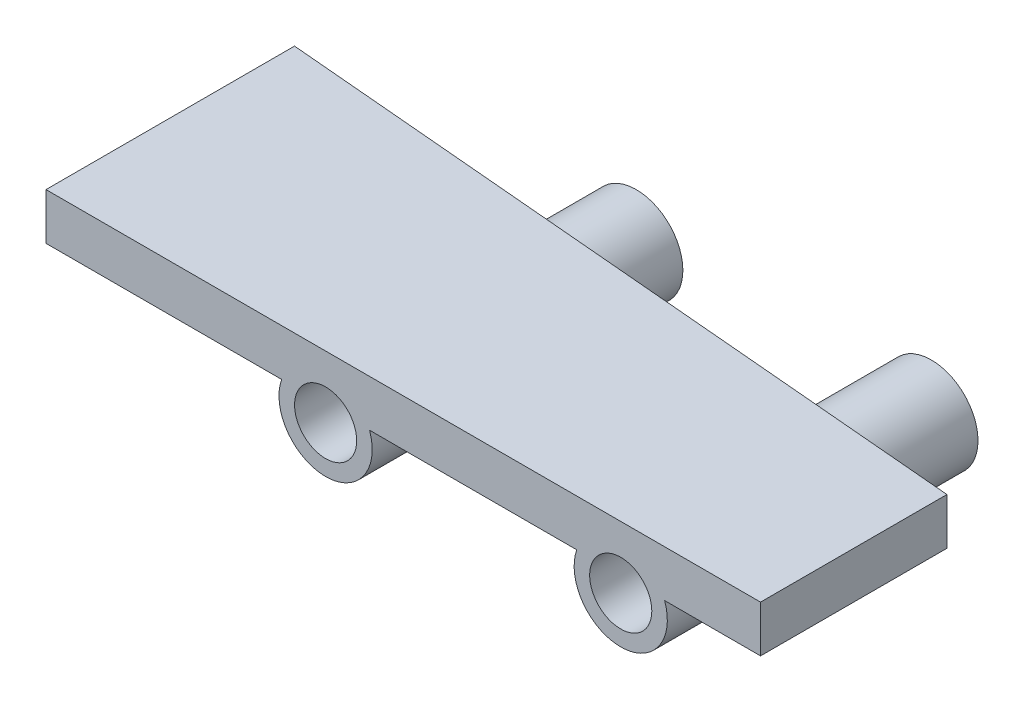
from build123d import *

# Parameters (mm, degrees)
BOSS_EXTRUDE1_DEPTH = 19.05
SKETCH6_R           = 19.05
SKETCH6_R_2         = 12.7
BOSS_EXTRUDE3_DEPTH = 127
CUT_EXTRUDE1_REACH  = 321.526
SKETCH7_R           = 12.7
CUT_EXTRUDE2_DEPTH  = 320.525538885


with BuildPart() as part:
    # Sketch1 → Boss-Extrude1 (new body)
    with BuildSketch(Plane(origin=(0, 0, 0), x_dir=(1, 0, 0), z_dir=(0, 1, 0))):
        Polygon((292.1, 76.2), (0, 101.6), (0, 0), (292.1, 0), align=None)
    extrude(amount=BOSS_EXTRUDE1_DEPTH)

    # Sketch6 → Boss-Extrude3 (add)
    # profile 1 of 2: a face of its own
    with BuildSketch(Plane.XY):
        with Locations((114.3, -6.35)):
            Circle(SKETCH6_R)
        with Locations((114.3, -6.35)):
            Circle(SKETCH6_R_2, mode=Mode.SUBTRACT)
    # profile 2 of 2: a face of its own
    with BuildSketch(Plane.XY):
        with Locations((234.95, -6.35)):
            Circle(SKETCH6_R)
        with Locations((234.95, -6.35)):
            Circle(SKETCH6_R_2, mode=Mode.SUBTRACT)
    extrude(amount=-BOSS_EXTRUDE3_DEPTH)

    # Cut-Extrude1: up to this face of the body (flat: up to its plane)
    cut_extrude1_end = Plane(part.part.faces().sort_by_distance((142.169333517, 10.10414021, -89.237449259))[0])
    # Sketch7 → Cut-Extrude1 (cut, up to the picked face)
    with BuildSketch(Plane.XY, mode=Mode.PRIVATE) as cut_extrude1_sk1:
        with Locations((114.3, -6.35)):
            Circle(SKETCH7_R)
    cut_extrude1_tool1 = split(extrude(cut_extrude1_sk1.sketch, amount=-CUT_EXTRUDE1_REACH, mode=Mode.PRIVATE), bisect_by=cut_extrude1_end, keep=Keep.BOTH, mode=Mode.PRIVATE)
    # Sketch7 → Cut-Extrude1 (cut, up to the picked face)
    with BuildSketch(Plane.XY, mode=Mode.PRIVATE) as cut_extrude1_sk2:
        with Locations((234.95, -6.35)):
            Circle(SKETCH7_R)
    cut_extrude1_tool2 = split(extrude(cut_extrude1_sk2.sketch, amount=-CUT_EXTRUDE1_REACH, mode=Mode.PRIVATE), bisect_by=cut_extrude1_end, keep=Keep.BOTH, mode=Mode.PRIVATE)
    add(cut_extrude1_tool1.solids().sort_by(Axis((114.3, -6.35, 0), (0, 0, -1)))[0], mode=Mode.SUBTRACT)
    add(cut_extrude1_tool2.solids().sort_by(Axis((234.95, -6.35, 0), (0, 0, -1)))[0], mode=Mode.SUBTRACT)

    # Sketch8 → Cut-Extrude2 (cut, through all)
    with BuildSketch(Plane.XZ):
        Polygon((132.260512242, -25.4), (0, -25.4), (0, -76.104150603), (132.260512242, -64.603236495), align=None)
        Polygon((216.989487758, -25.4), (132.260512242, -25.4), (132.260512242, -64.603236495), (216.989487758, -57.235499493), align=None)
        Polygon((292.1, -25.4), (216.989487758, -25.4), (216.989487758, -57.235499493), (292.1, -50.704150603), align=None)
    extrude(amount=CUT_EXTRUDE2_DEPTH, mode=Mode.SUBTRACT)


solid = part.part
